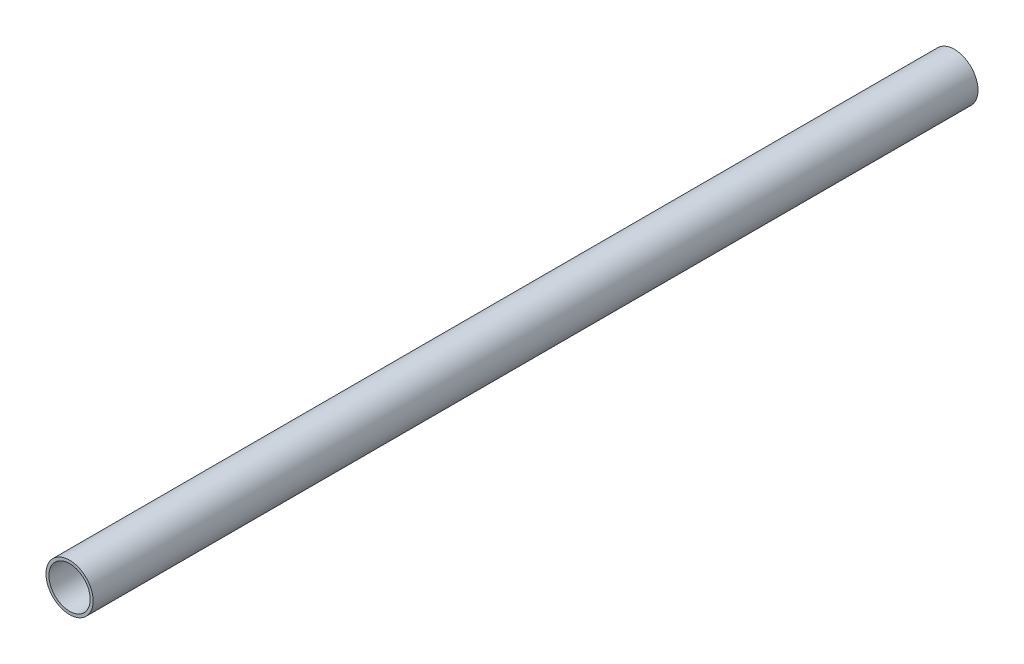
from build123d import *

# Parameters (mm, degrees)
SKETCH_1_R      = 4
SKETCH_1_R_2    = 3.5
EXTRUDE_1_DEPTH = 75


with BuildPart() as part:
    # Эскиз1 → Бобышка-Вытянуть1 (new, symmetric)
    with BuildSketch(Plane.XY):
        Circle(SKETCH_1_R)
        Circle(SKETCH_1_R_2, mode=Mode.SUBTRACT)
    extrude(amount=EXTRUDE_1_DEPTH, both=True)


solid = part.part
